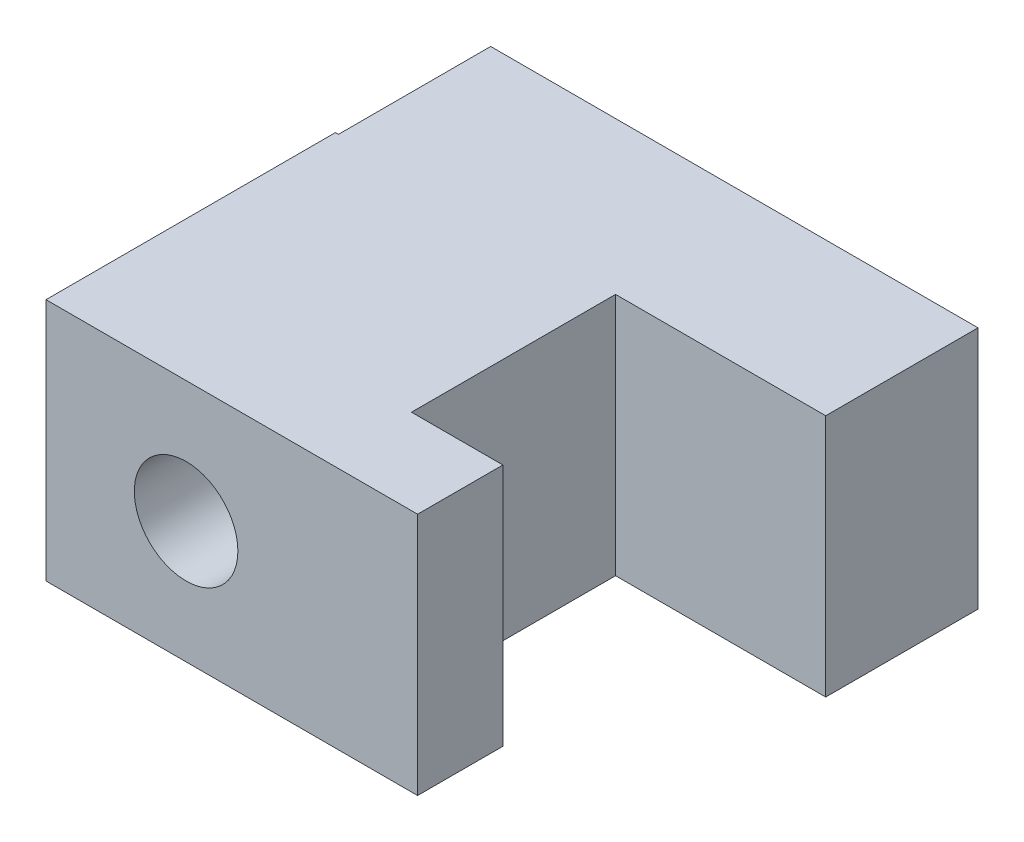
from build123d import *

# Parameters (mm, degrees)
SKETCH_FOOT_AND_SUPPORT_SHELF_W = 16
SKETCH_FOOT_AND_SUPPORT_SHELF_H = 8
FOOT_AND_SUPPORT_SHELF_DEPTH    = 5
CLAMP_UPRIGHT_START             = 5
SKETCH_CLAMP_UPRIGHT_W          = 9.2
SKETCH_CLAMP_UPRIGHT_H          = 8
CLAMP_UPRIGHT_DEPTH             = 6.7
CORNER_RETAINING_LIP_START      = 11.7
SKETCH_CORNER_RETAINING_LIP_W   = 12.2
SKETCH_CORNER_RETAINING_LIP_H   = 8
CORNER_RETAINING_LIP_DEPTH      = 2.8
M3_THROUGH_START                = -1
SKETCH_M3_THROUGH_R             = 1.7
M3_THROUGH_DEPTH                = 17


with BuildPart() as part:
    # Sketch_Foot_and_support_shelf → Foot_and_support_shelf (new body)
    with BuildSketch(Plane.XY):
        with Locations((3.5, 0)):
            Rectangle(SKETCH_FOOT_AND_SUPPORT_SHELF_W, SKETCH_FOOT_AND_SUPPORT_SHELF_H)
    extrude(amount=FOOT_AND_SUPPORT_SHELF_DEPTH)

    # Sketch_Clamp_upright → Clamp_upright (add)
    with BuildSketch(Plane.XY.offset(CLAMP_UPRIGHT_START)):
        Rectangle(SKETCH_CLAMP_UPRIGHT_W, SKETCH_CLAMP_UPRIGHT_H)
    extrude(amount=CLAMP_UPRIGHT_DEPTH)

    # Sketch_Corner_retaining_lip → Corner_retaining_lip (add)
    with BuildSketch(Plane.XY.offset(CORNER_RETAINING_LIP_START)):
        with Locations((1.5, 0)):
            Rectangle(SKETCH_CORNER_RETAINING_LIP_W, SKETCH_CORNER_RETAINING_LIP_H)
    extrude(amount=CORNER_RETAINING_LIP_DEPTH)

    # Sketch_M3_through → M3_through (cut)
    with BuildSketch(Plane.XY.offset(M3_THROUGH_START)):
        Circle(SKETCH_M3_THROUGH_R)
    extrude(amount=M3_THROUGH_DEPTH, mode=Mode.SUBTRACT)


solid = part.part
